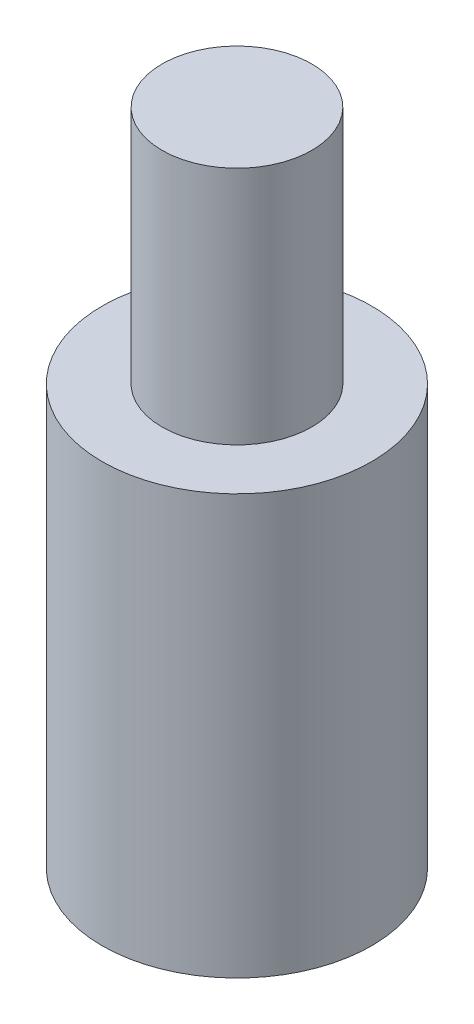
from build123d import *

# Parameters (mm, degrees)
SKETCH_1_R      = 2.25
SKETCH_1_R_2    = 1.25
EXTRUDE_1_DEPTH = 7
SKETCH_2_R      = 1.25
EXTRUDE_2_DEPTH = 4


with BuildPart() as part:
    # 草图1 → 凸台-拉伸1 (new body)
    with BuildSketch(Plane(origin=(0, 0, 0), x_dir=(1, 0, 0), z_dir=(0, 1, 0))):
        with Locations(Location((0, 0, 0), (0, 0, 270))):
            Circle(SKETCH_1_R)
        with Locations(Location((0, 0, 0), (0, 0, 270))):
            Circle(SKETCH_1_R_2, mode=Mode.SUBTRACT)
    extrude(amount=EXTRUDE_1_DEPTH)


with BuildPart() as body_2:
    # 草图2 → 凸台-拉伸2 (new body)
    with BuildSketch(Plane(origin=(0, 7, 0), x_dir=(1, 0, 0), z_dir=(0, 1, 0))):
        with Locations(Location((0, 0, 0), (0, 0, 270))):
            Circle(SKETCH_2_R)
    extrude(amount=EXTRUDE_2_DEPTH)


solid = Compound([part.part, body_2.part])
